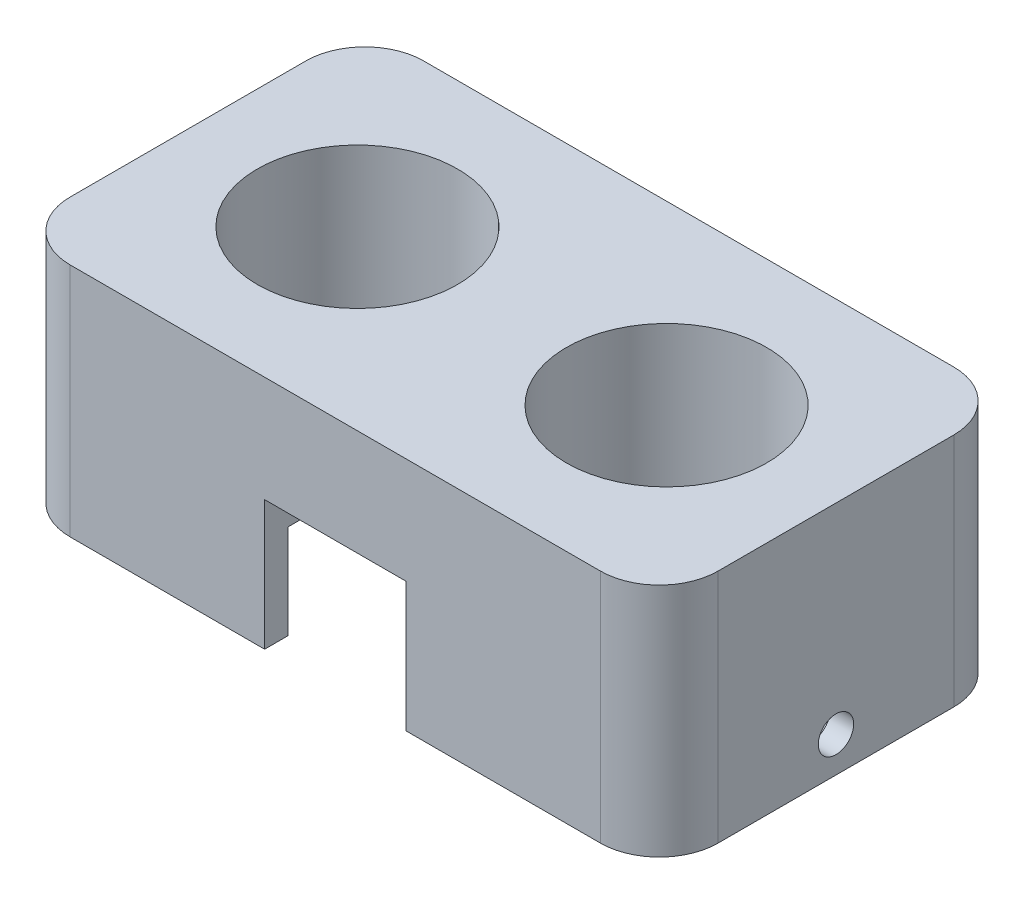
from build123d import *

# Parameters (mm, degrees)
SKETCH1_W                    = 55
SKETCH1_H                    = 30
BOSS_EXTRUDE1_DEPTH          = 12
SKETCH2_R                    = 8.5
CUT_EXTRUDE1_DEPTH           = 34.544746235
SKETCH4_W                    = 12
SKETCH4_H                    = 5
CUT_EXTRUDE2_DEPTH           = 5
FILLET1_R                    = 2
SKETCH5_W                    = 12
SKETCH5_H                    = 5
CUT_EXTRUDE3_DEPTH           = 3
FILLET2_R                    = 5
BOSS_EXTRUDE3_DEPTH          = 8
F_3_0MM_DOWEL_HOLE1_D        = 3
SKETCH10_W                   = 8
SKETCH10_H                   = 8
BOSS_EXTRUDE4_DEPTH          = 2
F_2_0_2_DIAMETER_HOLE1_D     = 2
F_2_0_2_DIAMETER_HOLE1_DEPTH = 10
F_2_0_2_DIAMETER_HOLE1_TIP   = 0.600860619


with BuildPart() as part:
    # Sketch1 → Boss-Extrude1 (new body)
    with BuildSketch(Plane(origin=(0, 0, 0), x_dir=(1, 0, 0), z_dir=(0, 1, 0))):
        Rectangle(SKETCH1_W, SKETCH1_H)
    extrude(amount=BOSS_EXTRUDE1_DEPTH)

    # Sketch2 → Cut-Extrude1 (cut, through all)
    with BuildSketch(Plane(origin=(0, 12, 0), x_dir=(1, 0, 0), z_dir=(0, 1, 0))):
        with Locations(Location((-13.12, 0, 0), (0, 0, 270))):
            Circle(SKETCH2_R)
        with Locations(Location((13.12, 0, 0), (0, 0, 270))):
            Circle(SKETCH2_R)
    extrude(amount=-CUT_EXTRUDE1_DEPTH, mode=Mode.SUBTRACT)

    # Sketch4 → Cut-Extrude2 (cut)
    with BuildSketch(Plane.XZ):
        with Locations((0, -7.5)):
            Rectangle(SKETCH4_W, SKETCH4_H)
    extrude(amount=-CUT_EXTRUDE2_DEPTH, mode=Mode.SUBTRACT)

    # Fillet1
    fillet1_edges = [part.edges().sort_by_distance(p)[0] for p in [
        (-6, 2.5, -10),
        (-6, 2.5, -5),
        (6, 2.5, -5),
        (6, 2.5, -10),
    ]]
    fillet(fillet1_edges, radius=FILLET1_R)

    # Sketch5 → Cut-Extrude3 (cut)
    with BuildSketch(Plane.XZ):
        with Locations((0, 12.5)):
            Rectangle(SKETCH5_W, SKETCH5_H)
    extrude(amount=-CUT_EXTRUDE3_DEPTH, mode=Mode.SUBTRACT)

    # Fillet2
    fillet2_edges = [part.edges().sort_by_distance(p)[0] for p in [
        (27.5, 6, 15),
        (-27.5, 6, 15),
        (-27.5, 6, -15),
        (27.5, 6, -15),
    ]]
    fillet(fillet2_edges, radius=FILLET2_R)

    # Sketch6 → Boss-Extrude3 (add)
    with BuildSketch(Plane.XZ):
        with BuildLine():
            Line((25.5, 10), (25.5, -10))
            ThreePointArc((25.5, -10), (24.621320344, -12.121320344), (22.5, -13))
            Line((22.5, -13), (-22.5, -13))
            ThreePointArc((-22.5, -13), (-24.621320344, -12.121320344), (-25.5, -10))
            Line((-25.5, -10), (-25.5, 10))
            ThreePointArc((-25.5, 10), (-24.621320344, 12.121320344), (-22.5, 13))
            Line((-22.5, 13), (-8, 13))
            Line((-8, 13), (-6, 13))
            Line((-6, 13), (-6, 15))
            Line((-6, 15), (-22.5, 15))
            ThreePointArc((-22.5, 15), (-26.035533906, 13.535533906), (-27.5, 10))
            Line((-27.5, 10), (-27.5, -10))
            ThreePointArc((-27.5, -10), (-26.035533906, -13.535533906), (-22.5, -15))
            Line((-22.5, -15), (22.5, -15))
            ThreePointArc((22.5, -15), (26.035533906, -13.535533906), (27.5, -10))
            Line((27.5, -10), (27.5, 10))
            ThreePointArc((27.5, 10), (26.035533906, 13.535533906), (22.5, 15))
            Line((22.5, 15), (6, 15))
            Line((6, 15), (6, 13))
            Line((6, 13), (8, 13))
            Line((8, 13), (22.5, 13))
            ThreePointArc((22.5, 13), (24.621320344, 12.121320344), (25.5, 10))
        make_face()
    extrude(amount=BOSS_EXTRUDE3_DEPTH)

    # Ø3.0mm Dowel Hole1 (through all)
    with Locations(Plane.ZY.offset(27.5)):
        with Locations((0, -5)):
            Hole(F_3_0MM_DOWEL_HOLE1_D / 2)

    # Sketch10 → Boss-Extrude4 (add)
    with BuildSketch(Plane.ZY.offset(-25.5)):
        with Locations((0, -4)):
            Rectangle(SKETCH10_W, SKETCH10_H)
        Polygon((2.771281292, -5), (1.385640646, -2.6), (-1.385640646, -2.6), (-2.771281292, -5), (-1.385640646, -7.4), (1.385640646, -7.4), align=None, mode=Mode.SUBTRACT)
    boss_extrude4 = extrude(amount=BOSS_EXTRUDE4_DEPTH)

    # Mirror1: Boss-Extrude4 across plane
    add(boss_extrude4.mirror(Plane(origin=(0, 0, 0), x_dir=(0, 0, 1), z_dir=(1, 0, 0))))

    # Ø2.0 (2) Diameter Hole1
    with Locations(Plane(origin=(0, 0, 0), x_dir=(-1, 0, 0), z_dir=(0, -1, 0))):
        with Locations((-21.425, 8.7), (21.425, 8.7), (21.425, -8.7), (-21.425, -8.7)):
            Hole(F_2_0_2_DIAMETER_HOLE1_D / 2, depth=F_2_0_2_DIAMETER_HOLE1_DEPTH)
            with Locations((0, 0, -(F_2_0_2_DIAMETER_HOLE1_DEPTH + F_2_0_2_DIAMETER_HOLE1_TIP / 2))):  # 118° drill point
                Cone(0, F_2_0_2_DIAMETER_HOLE1_D / 2, F_2_0_2_DIAMETER_HOLE1_TIP, mode=Mode.SUBTRACT)


solid = part.part
